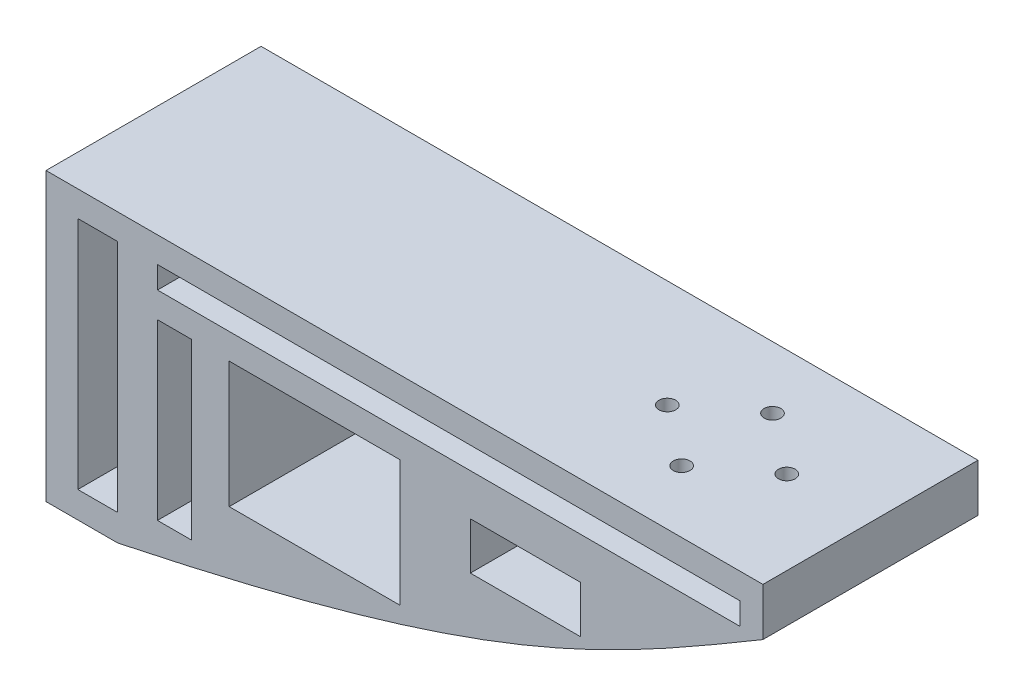
from build123d import *

# Parameters (mm, degrees)
SKETCH3_W           = 8.345017316
SKETCH3_H           = 49.099302906
SKETCH3_W_2         = 121.839010914
SKETCH3_H_2         = 4.625421982
SKETCH3_W_3         = 7.122429743
SKETCH3_H_3         = 36.369854004
SKETCH3_W_4         = 35.763689771
SKETCH3_H_4         = 26.368144153
SKETCH3_W_5         = 23.034240869
SKETCH3_H_5         = 9.850168793
BOSS_EXTRUDE1_DEPTH = 22.5
CUT_EXTRUDE1_START  = -3.567987
SKETCH4_R           = 1.75
CUT_EXTRUDE1_DEPTH  = 33.567987


with BuildPart() as part:
    # Sketch3 → Boss-Extrude1 (new, symmetric)
    with BuildSketch(Plane.XY):
        with BuildLine():
            Line((0, -30), (0, 30))
            Line((0, 30), (150, 30))
            Line((150, 30), (150, 20))
            add(Edge.make_bspline(
                [(15, -30), (91.992434152, -13.820271626), (115.288714067, -0.58029396), (150, 20)],
                knots=[0, 0, 0, 0, 1, 1, 1, 1], degree=3))
            Line((15, -30), (0, -30))
        make_face()
        with Locations((10.827491342, 0.075770529)):
            Rectangle(SKETCH3_W, SKETCH3_H, mode=Mode.SUBTRACT)
        with Locations((84.244004559, 22.312710991)):
            Rectangle(SKETCH3_W_2, SKETCH3_H_2, mode=Mode.SUBTRACT)
        with Locations((26.885713974, -3.561214871)):
            Rectangle(SKETCH3_W_3, SKETCH3_H_3, mode=Mode.SUBTRACT)
        with Locations((56.208908765, 1.439640054)):
            Rectangle(SKETCH3_W_4, SKETCH3_H_4, mode=Mode.SUBTRACT)
        with Locations((100.307356745, 6.364724451)):
            Rectangle(SKETCH3_W_5, SKETCH3_H_5, mode=Mode.SUBTRACT)
    extrude(amount=BOSS_EXTRUDE1_DEPTH, both=True)

    # Sketch4 → Cut-Extrude1 (cut)
    with BuildSketch(Plane(origin=(0, 0, 0), x_dir=(1, 0, 0), z_dir=(0, 1, 0)).offset(CUT_EXTRUDE1_START)):
        with Locations(Location((107.5, 0, 0), (0, 0, 270))):
            Circle(SKETCH4_R)
        with Locations(Location((120, 9.5, 0), (0, 0, 270))):
            Circle(SKETCH4_R)
        with Locations(Location((132.5, 0, 0), (0, 0, 270))):
            Circle(SKETCH4_R)
        with Locations(Location((120, -9.5, 0), (0, 0, 270))):
            Circle(SKETCH4_R)
    extrude(amount=CUT_EXTRUDE1_DEPTH, mode=Mode.SUBTRACT)


solid = part.part
